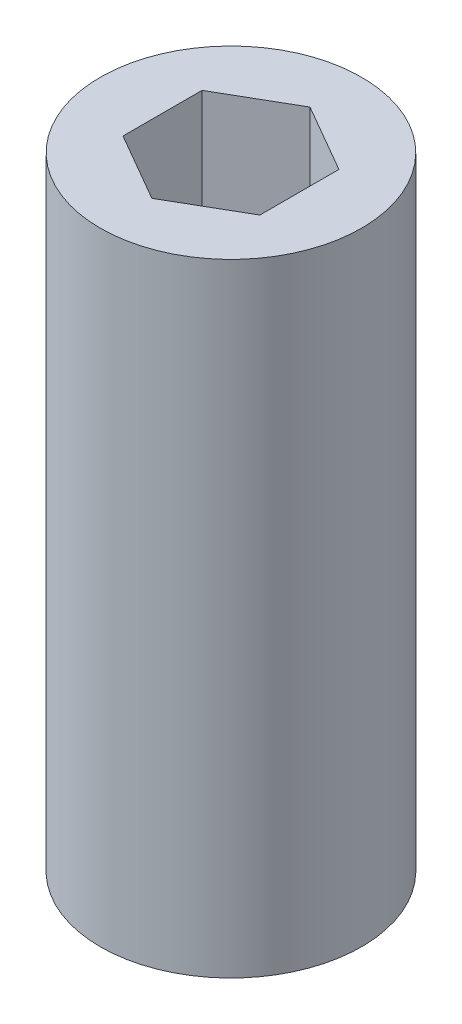
from build123d import *

# Parameters (mm, degrees)
SKETCH1_R           = 2.1
BOSS_EXTRUDE1_DEPTH = 10


with BuildPart() as part:
    # Sketch1 → Boss-Extrude1 (new body)
    with BuildSketch(Plane(origin=(0, 0, 0), x_dir=(1, 0, 0), z_dir=(0, 1, 0))):
        Circle(SKETCH1_R)
        Polygon((1.1, -0.635085296), (1.1, 0.635085296), (0, 1.270170592), (-1.1, 0.635085296), (-1.1, -0.635085296), (0, -1.270170592), align=None, mode=Mode.SUBTRACT)
    extrude(amount=BOSS_EXTRUDE1_DEPTH)


solid = part.part
